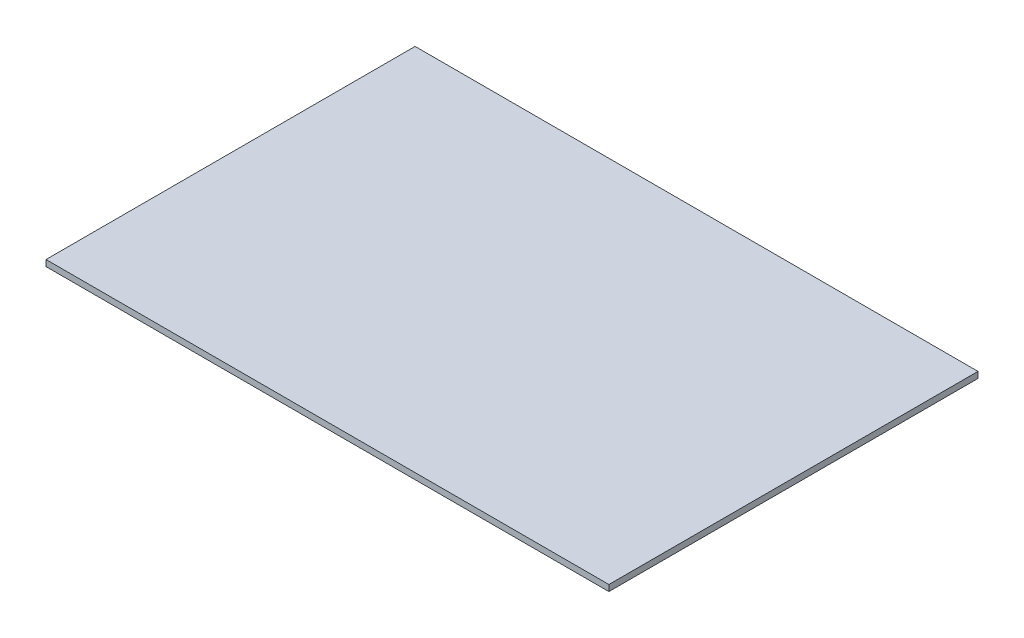
from build123d import *

# Parameters (mm, degrees)
SKETCH1_W           = 914.4
SKETCH1_H           = 599.6
BOSS_EXTRUDE1_DEPTH = 10


with BuildPart() as part:
    # Sketch1 → Boss-Extrude1 (new body)
    with BuildSketch(Plane(origin=(0, 0, 0), x_dir=(1, 0, 0), z_dir=(0, 1, 0))):
        with Locations((-457.2, -299.8)):
            Rectangle(SKETCH1_W, SKETCH1_H)
    extrude(amount=BOSS_EXTRUDE1_DEPTH)


solid = part.part
